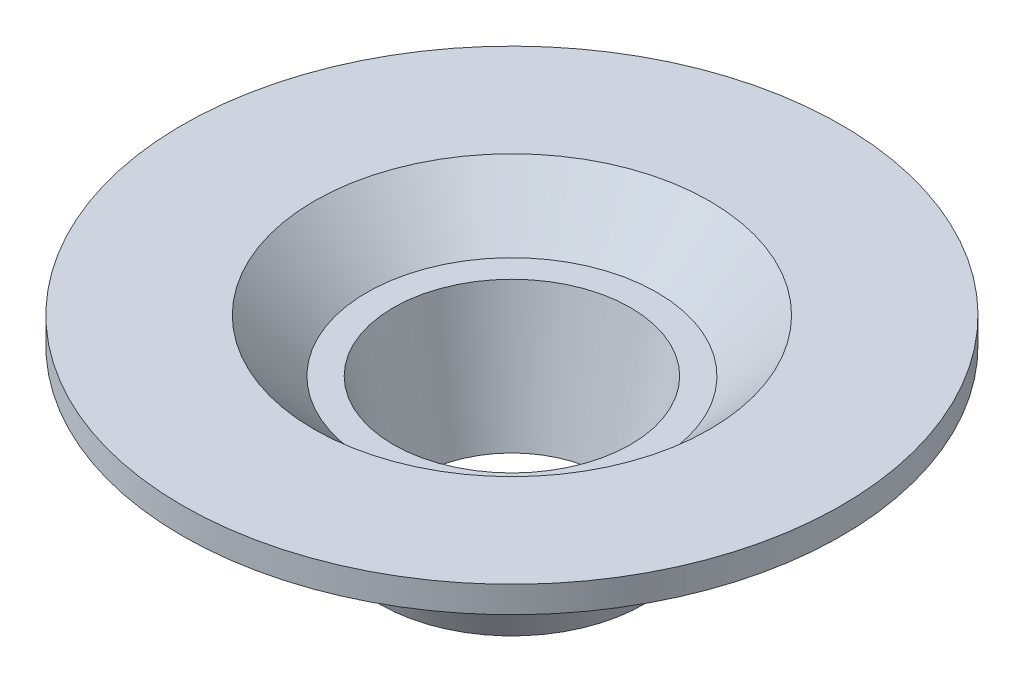
from build123d import *


with BuildPart() as part:
    # Sketch1 → Revolve1 (revolve)
    with BuildSketch(Plane(origin=(0, 0, 0), x_dir=(0, 0, -1), z_dir=(1, 0, 0)), mode=Mode.PRIVATE) as revolve1_sk:
        Polygon((14, -20), (18, 0), (22, 0), (30, 8), (50, 8), (50, 4), (42, 4), (34, -4), (26, -4), (20, -20), align=None)
    revolve(revolve1_sk.sketch.rotate(Axis((0, 0, 0), (0, -1, 0)), 180), axis=Axis((0, 0, 0), (0, -1, 0)))


solid = part.part
